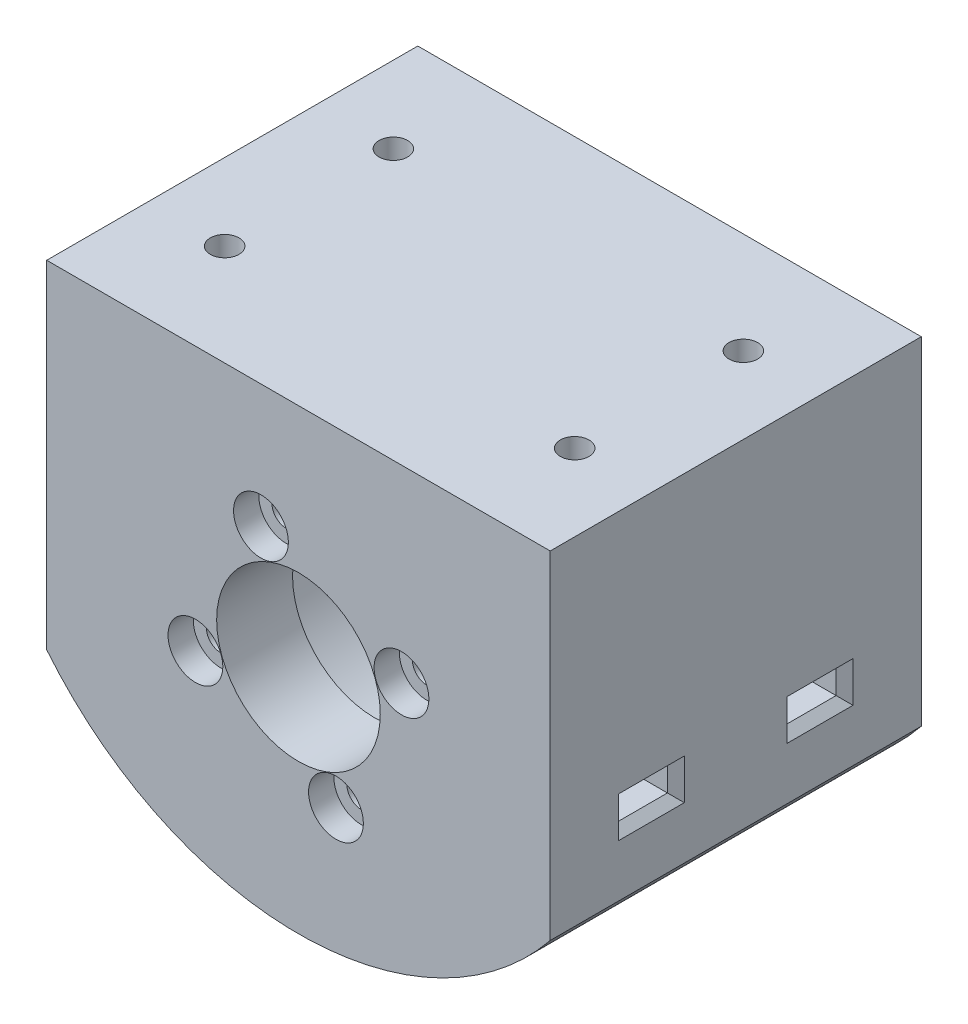
from build123d import *

# Parameters (mm, degrees)
BOSS_EXTRUDE1_DEPTH            = 44
CUT_EXTRUDE1_DEPTH             = 35
CUT_EXTRUDE2_REACH             = 67.586
SKETCH2_R                      = 9.7
CBORE_FOR_M3_SHCS1_D           = 3.4
CBORE_FOR_M3_SHCS1_CBORE_D     = 6.5
CBORE_FOR_M3_SHCS1_CBORE_DEPTH = 3
CUT_EXTRUDE3_REACH             = 82.169
SKETCH6_R                      = 1.7
CUT_EXTRUDE4_DEPTH             = 2.8
CHAMFER1_SIZE                  = 1


with BuildPart() as part:
    # Sketch1 → Boss-Extrude1 (new body)
    with BuildSketch(Plane.XY):
        with BuildLine():
            Line((-9.452299133, -24.156520859), (-29.85, -24.156520859))
            ThreePointArc((-29.85, -24.156520859), (0, -38.4), (29.85, -24.156520859))
            Line((29.85, -24.156520859), (9.452299133, -24.156520859))
            ThreePointArc((9.452299133, -24.156520859), (0, -27.2), (-9.452299133, -24.156520859))
        make_face()
        with BuildLine():
            Line((29.85, 15.843479141), (-29.85, 15.843479141))
            Line((-29.85, 15.843479141), (-29.85, -24.156520859))
            Line((-29.85, -24.156520859), (-9.452299133, -24.156520859))
            ThreePointArc((-9.452299133, -24.156520859), (-7.392995132, 3.414701626), (16.2, -11))
            ThreePointArc((16.2, -11), (14.414701626, -18.392995132), (9.452299133, -24.156520859))
            Line((9.452299133, -24.156520859), (29.85, -24.156520859))
            Line((29.85, -24.156520859), (29.85, 15.843479141))
        make_face()
        with BuildLine():
            ThreePointArc((16.2, -11), (-7.392995132, 3.414701626), (-9.452299133, -24.156520859))
            Line((-9.452299133, -24.156520859), (9.452299133, -24.156520859))
            ThreePointArc((9.452299133, -24.156520859), (14.414701626, -18.392995132), (16.2, -11))
        make_face()
        with BuildLine():
            Line((9.452299133, -24.156520859), (-9.452299133, -24.156520859))
            ThreePointArc((-9.452299133, -24.156520859), (0, -27.2), (9.452299133, -24.156520859))
        make_face()
    extrude(amount=BOSS_EXTRUDE1_DEPTH)

    # Sketch1<3> → Cut-Extrude1 (cut)
    with BuildSketch(Plane.XY):
        with BuildLine():
            ThreePointArc((16.2, -11), (-7.392995132, 3.414701626), (-9.452299133, -24.156520859))
            Line((-9.452299133, -24.156520859), (9.452299133, -24.156520859))
            ThreePointArc((9.452299133, -24.156520859), (14.414701626, -18.392995132), (16.2, -11))
        make_face()
        with BuildLine():
            Line((9.452299133, -24.156520859), (-9.452299133, -24.156520859))
            ThreePointArc((-9.452299133, -24.156520859), (0, -27.2), (9.452299133, -24.156520859))
        make_face()
    extrude(amount=CUT_EXTRUDE1_DEPTH, mode=Mode.SUBTRACT)

    # Sketch2 → Cut-Extrude2 (cut, up to next)
    with BuildSketch(Plane.XY.offset(44), mode=Mode.PRIVATE) as cut_extrude2_sk1:
        with Locations((0, -11)):
            Circle(SKETCH2_R)
    cut_extrude2_tool1 = extrude(cut_extrude2_sk1.sketch, amount=-CUT_EXTRUDE2_REACH, mode=Mode.PRIVATE) & part.part
    add(cut_extrude2_tool1.solids().sort_by_distance((0, -11, 44))[0], mode=Mode.SUBTRACT)

    # CBORE for M3 SHCS1 (through all)
    with Locations(Plane.XY.offset(44)):
        with Locations((-12.21600407, -15.446261863), (12.21600407, -6.553738137), (4.446261863, -23.21600407), (-4.446261863, 1.21600407)):
            CounterBoreHole(CBORE_FOR_M3_SHCS1_D / 2, CBORE_FOR_M3_SHCS1_CBORE_D / 2, CBORE_FOR_M3_SHCS1_CBORE_DEPTH)

    # Sketch6 → Cut-Extrude3 (cut, up to next)
    with BuildSketch(Plane(origin=(0, -44.156520859, 0), x_dir=(-1, 0, 0), z_dir=(0, -1, 0)), mode=Mode.PRIVATE) as cut_extrude3_sk1:
        with Locations(Location((20.75, -12, 0), (0, 0, 180))):
            Circle(SKETCH6_R)
    cut_extrude3_tool1 = extrude(cut_extrude3_sk1.sketch, amount=-CUT_EXTRUDE3_REACH, mode=Mode.PRIVATE) & part.part
    # Sketch6 → Cut-Extrude3 (cut, up to next)
    with BuildSketch(Plane(origin=(0, -44.156520859, 0), x_dir=(-1, 0, 0), z_dir=(0, -1, 0)), mode=Mode.PRIVATE) as cut_extrude3_sk2:
        with Locations(Location((-20.75, -12, 0), (0, 0, 180))):
            Circle(SKETCH6_R)
    cut_extrude3_tool2 = extrude(cut_extrude3_sk2.sketch, amount=-CUT_EXTRUDE3_REACH, mode=Mode.PRIVATE) & part.part
    # Sketch6 → Cut-Extrude3 (cut, up to next)
    with BuildSketch(Plane(origin=(0, -44.156520859, 0), x_dir=(-1, 0, 0), z_dir=(0, -1, 0)), mode=Mode.PRIVATE) as cut_extrude3_sk3:
        with Locations(Location((20.75, -32, 0), (0, 0, 180))):
            Circle(SKETCH6_R)
    cut_extrude3_tool3 = extrude(cut_extrude3_sk3.sketch, amount=-CUT_EXTRUDE3_REACH, mode=Mode.PRIVATE) & part.part
    # Sketch6 → Cut-Extrude3 (cut, up to next)
    with BuildSketch(Plane(origin=(0, -44.156520859, 0), x_dir=(-1, 0, 0), z_dir=(0, -1, 0)), mode=Mode.PRIVATE) as cut_extrude3_sk4:
        with Locations(Location((-20.75, -32, 0), (0, 0, 180))):
            Circle(SKETCH6_R)
    cut_extrude3_tool4 = extrude(cut_extrude3_sk4.sketch, amount=-CUT_EXTRUDE3_REACH, mode=Mode.PRIVATE) & part.part
    add(cut_extrude3_tool1.solids().sort_by_distance((-20.75, -44.156521, 12))[0], mode=Mode.SUBTRACT)
    add(cut_extrude3_tool2.solids().sort_by_distance((20.75, -44.156521, 12))[0], mode=Mode.SUBTRACT)
    add(cut_extrude3_tool3.solids().sort_by_distance((-20.75, -44.156521, 32))[0], mode=Mode.SUBTRACT)
    add(cut_extrude3_tool4.solids().sort_by_distance((20.75, -44.156521, 32))[0], mode=Mode.SUBTRACT)

    # Sketch7 → Cut-Extrude4 (cut)
    with BuildSketch(Plane(origin=(0, -14.156520859, 0), x_dir=(1, 0, 0), z_dir=(0, 1, 0))):
        Polygon((-29.85, -14.9), (-29.85, -9.1), (-22.424315781, -9.1), (-24.098631561, -12), (-22.424315781, -14.9), align=None)
        Polygon((-24.098631561, -12), (-22.424315781, -14.9), (-22.424315781, -9.1), align=None)
        Polygon((-22.424315781, -14.9), (-22.424315781, -9.1), (-19.075684219, -9.1), (-17.401368439, -12), (-19.075684219, -14.9), align=None)
        Polygon((-29.85, -34.9), (-29.85, -29.1), (-22.424315781, -29.1), (-24.098631561, -32), (-22.424315781, -34.9), align=None)
        Polygon((-24.098631561, -32), (-22.424315781, -34.9), (-22.424315781, -29.1), align=None)
        Polygon((-22.424315781, -34.9), (-22.424315781, -29.1), (-19.075684219, -29.1), (-17.401368439, -32), (-19.075684219, -34.9), align=None)
        Polygon((22.424315781, -29.1), (22.424315781, -34.9), (19.075684219, -34.9), (17.401368439, -32), (19.075684219, -29.1), align=None)
        Polygon((29.85, -29.1), (29.85, -34.9), (22.424315781, -34.9), (24.098631561, -32), (22.424315781, -29.1), align=None)
        Polygon((24.098631561, -32), (22.424315781, -29.1), (22.424315781, -34.9), align=None)
        Polygon((24.098631561, -12), (22.424315781, -9.1), (29.85, -9.1), (29.85, -14.9), (22.424315781, -14.9), align=None)
        Polygon((22.424315781, -14.9), (24.098631561, -12), (22.424315781, -9.1), align=None)
        Polygon((22.424315781, -9.1), (19.075684219, -9.1), (17.401368439, -12), (19.075684219, -14.9), (22.424315781, -14.9), align=None)
    extrude(amount=-CUT_EXTRUDE4_DEPTH, mode=Mode.SUBTRACT)

    # Chamfer1
    chamfer1_edges = [part.edges().sort_by_distance(p)[0] for p in [
        (29.85, -16.956520859, 32),
        (29.85, -14.156520859, 32),
        (29.85, -15.556520859, 29.1),
        (29.85, -15.556520859, 34.9),
        (-29.85, -16.956520859, 32),
        (-29.85, -14.156520859, 32),
        (-29.85, -15.556520859, 34.9),
        (-29.85, -15.556520859, 29.1),
        (-29.85, -16.956520859, 12),
        (-29.85, -14.156520859, 12),
        (-29.85, -15.556520859, 14.9),
        (-29.85, -15.556520859, 9.1),
        (29.85, -16.956520859, 12),
        (29.85, -14.156520859, 12),
        (29.85, -15.556520859, 9.1),
        (29.85, -15.556520859, 14.9),
    ]]
    chamfer(chamfer1_edges, length=CHAMFER1_SIZE)


solid = part.part
